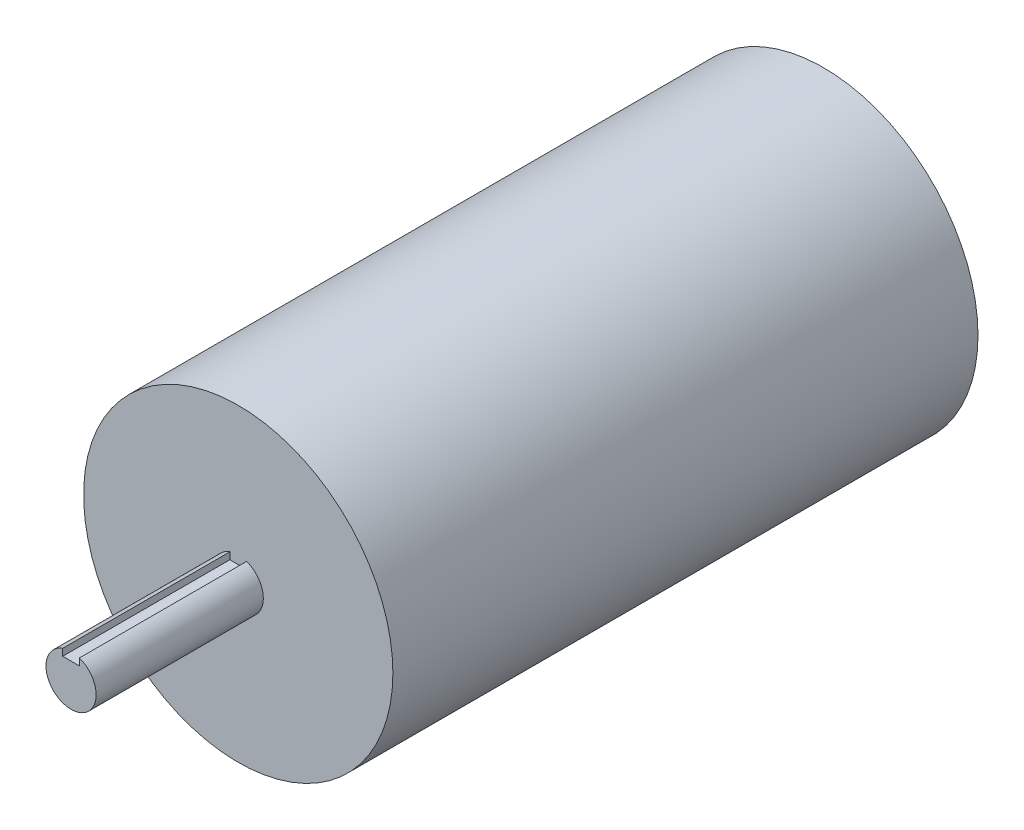
from build123d import *

# Parameters (mm, degrees)
SKETCH_1_R      = 18.5
EXTRUDE_1_DEPTH = 35
EXTRUDE_2_DEPTH = 20


with BuildPart() as part:
    # 草图1 → 凸台-拉伸1 (new, symmetric)
    with BuildSketch(Plane.XY):
        Circle(SKETCH_1_R)
    extrude(amount=EXTRUDE_1_DEPTH, both=True)

    # 草图2 → 凸台-拉伸2 (add)
    with BuildSketch(Plane.XY.offset(35)):
        with BuildLine():
            Line((-1, 2.828427125), (-1, 2))
            Line((-1, 2), (1, 2))
            Line((1, 2), (1, 2.828427125))
            ThreePointArc((1, 2.828427125), (0, -3), (-1, 2.828427125))
        make_face()
    extrude(amount=EXTRUDE_2_DEPTH)


solid = part.part
